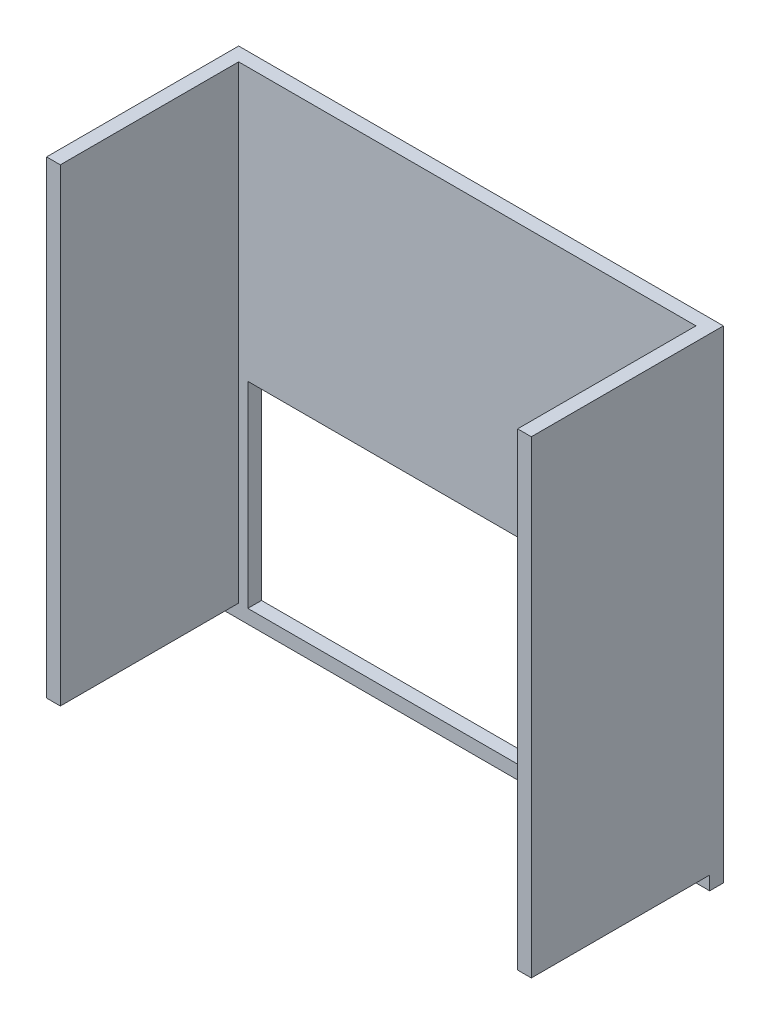
from build123d import *

# Parameters (mm, degrees)
SKETCH1_W                = 100
SKETCH1_H                = 77.5
BOSS_EXTRUDE1_DEPTH      = 3
BOSS_EXTRUDE2_DEPTH      = 102.5
BOSS_EXTRUDE2_DEPTH_BACK = 3
SKETCH2_W                = 106
SKETCH2_H                = 83.5
SKETCH2_W_2              = 100
SKETCH2_H_2              = 77.5
SKETCH3_W                = 106
SKETCH3_H                = 105.5
CUT_EXTRUDE1_DEPTH       = 41.5
CUT_EXTRUDE3_REACH       = 127.313
SKETCH6_W                = 96
SKETCH6_H                = 43
SKETCH7_W                = 106
SKETCH7_H                = 3
CUT_EXTRUDE4_DEPTH       = 39


with BuildPart() as part:
    # Sketch1 → Boss-Extrude1 (new body)
    with BuildSketch(Plane(origin=(0, 0, 0), x_dir=(1, 0, 0), z_dir=(0, 1, 0))):
        Rectangle(SKETCH1_W, SKETCH1_H)
    extrude(amount=BOSS_EXTRUDE1_DEPTH)

    # Sketch2 → Boss-Extrude2 (add, two sides: drawn at the far end of the back side and taken through both)
    with BuildSketch(Plane(origin=(0, 3, 0), x_dir=(1, 0, 0), z_dir=(0, 1, 0)).offset(-BOSS_EXTRUDE2_DEPTH_BACK)):
        Rectangle(SKETCH2_W, SKETCH2_H)
        Rectangle(SKETCH2_W_2, SKETCH2_H_2, mode=Mode.SUBTRACT)
    extrude(amount=BOSS_EXTRUDE2_DEPTH + BOSS_EXTRUDE2_DEPTH_BACK)

    # Sketch3 → Cut-Extrude1 (cut)
    with BuildSketch(Plane(origin=(0, 0, 41.75), x_dir=(-1, 0, 0), z_dir=(0, 0, -1))):
        with Locations((0, 52.75)):
            Rectangle(SKETCH3_W, SKETCH3_H)
    extrude(amount=CUT_EXTRUDE1_DEPTH, mode=Mode.SUBTRACT)

    # Sketch6 → Cut-Extrude3 (cut, up to next)
    with BuildSketch(Plane(origin=(0, 0, -41.75), x_dir=(-1, 0, 0), z_dir=(0, 0, -1)), mode=Mode.PRIVATE) as cut_extrude3_sk1:
        with Locations((0, 24.5)):
            Rectangle(SKETCH6_W, SKETCH6_H)
    cut_extrude3_tool1 = extrude(cut_extrude3_sk1.sketch, amount=-CUT_EXTRUDE3_REACH, mode=Mode.PRIVATE) & part.part
    add(cut_extrude3_tool1.solids().sort_by_distance((0, 24.5, -41.75))[0], mode=Mode.SUBTRACT)

    # Sketch7 → Cut-Extrude4 (cut)
    with BuildSketch(Plane.XY.offset(0.25)):
        with Locations((0, 1.5)):
            Rectangle(SKETCH7_W, SKETCH7_H)
    extrude(amount=-CUT_EXTRUDE4_DEPTH, mode=Mode.SUBTRACT)


solid = part.part
